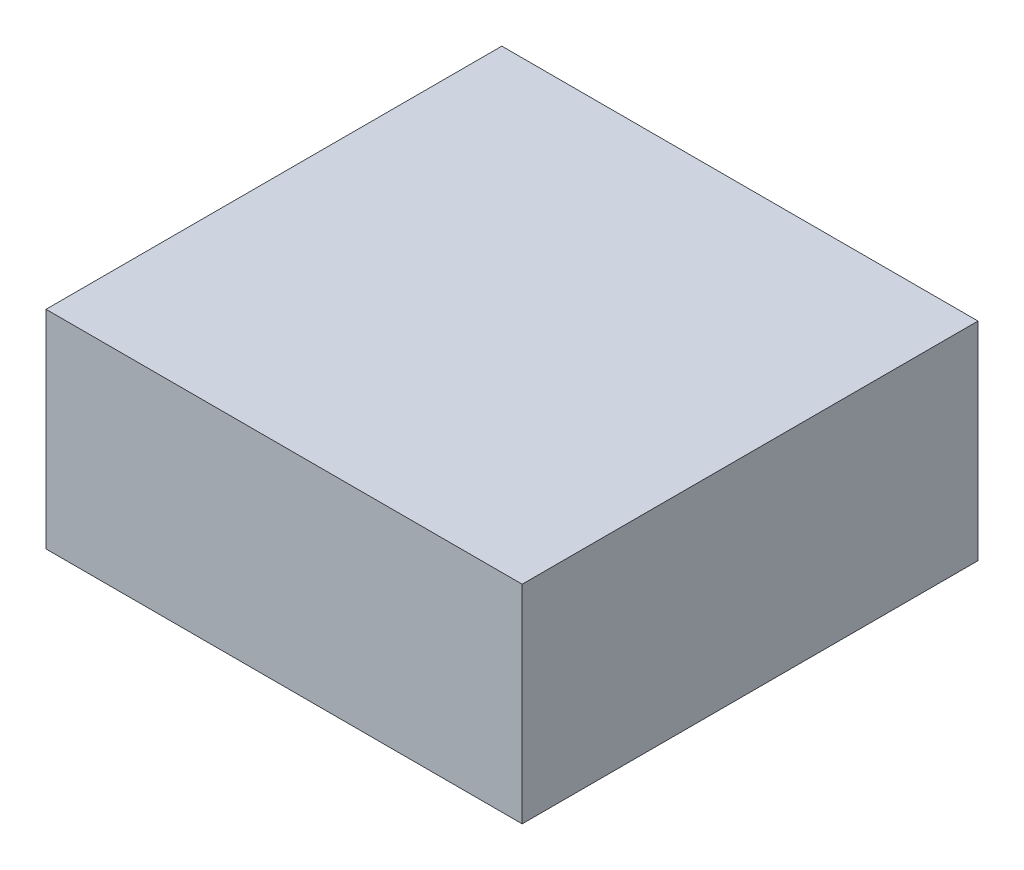
from build123d import *

# Parameters (mm, degrees)
SKETCH_1_W      = 117
SKETCH_1_H      = 51
EXTRUDE_1_DEPTH = 56


with BuildPart() as part:
    # ｽｹｯﾁ1 → ﾎﾞｽ - 押し出し1 (new, symmetric)
    with BuildSketch(Plane.XY):
        Rectangle(SKETCH_1_W, SKETCH_1_H)
    extrude(amount=EXTRUDE_1_DEPTH, both=True)


solid = part.part
